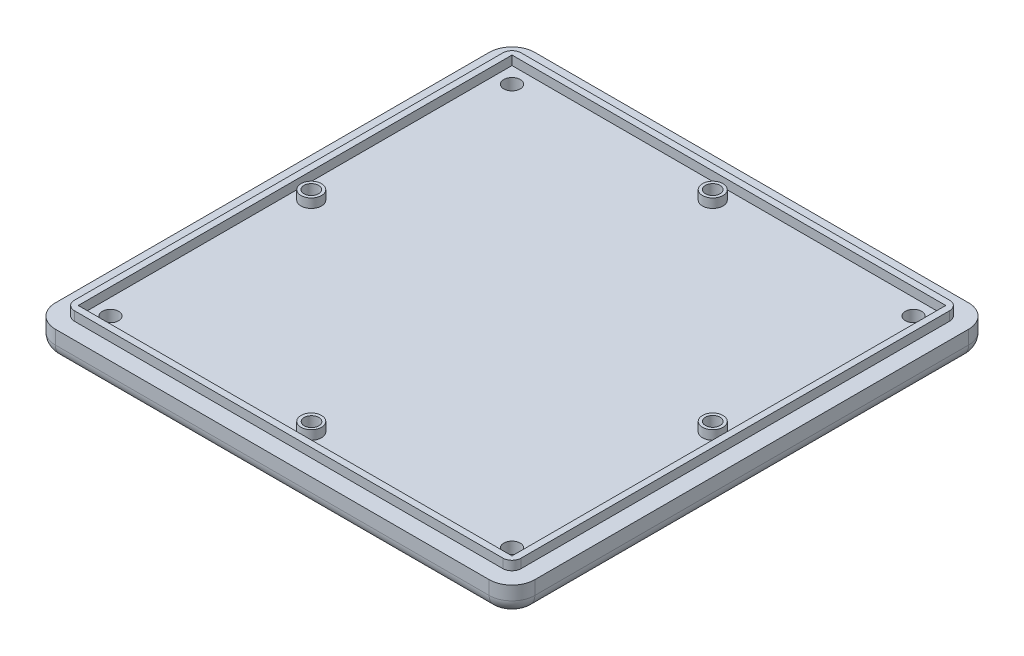
from build123d import *

# Parameters (mm, degrees)
BOSS_EXTRUDE1_DEPTH                             = 6
FILLET1_R                                       = 3
CSK_FOR_M3_FLAT_HEAD_MACHINE_SCREW1_D           = 3.6
CSK_FOR_M3_FLAT_HEAD_MACHINE_SCREW1_CSINK_D     = 6.3
CSK_FOR_M3_FLAT_HEAD_MACHINE_SCREW1_CSINK_ANGLE = 90
SKETCH5_W                                       = 95
SKETCH5_H                                       = 95
BOSS_EXTRUDE2_DEPTH                             = 2
SKETCH6_R                                       = 2.25
BOSS_EXTRUDE3_DEPTH                             = 2
M3_CLEARANCE_HOLE1_D                            = 3.2
M3_CLEARANCE_HOLE1_DEPTH                        = 5
M3_CLEARANCE_HOLE1_TIP                          = 0.96137699


with BuildPart() as part:
    # Sketch1 → Boss-Extrude1 (new body)
    with BuildSketch(Plane(origin=(0, 0, 0), x_dir=(1, 0, 0), z_dir=(0, 1, 0))):
        with BuildLine():
            Line((5, 0), (100, 0))
            ThreePointArc((100, 0), (103.535533906, 1.464466094), (105, 5))
            Line((105, 5), (105, 100))
            ThreePointArc((105, 100), (103.535533906, 103.535533906), (100, 105))
            Line((100, 105), (5, 105))
            ThreePointArc((5, 105), (1.464466094, 103.535533906), (0, 100))
            Line((0, 100), (0, 5))
            ThreePointArc((0, 5), (1.464466094, 1.464466094), (5, 0))
        make_face()
    extrude(amount=BOSS_EXTRUDE1_DEPTH)

    # Fillet1
    fillet1_edges = [part.edges().sort_by_distance(p)[0] for p in [
        (52.5, 0, -105),
        (103.535533906, 0, -103.535533906),
        (105, 0, -52.5),
        (103.535533906, 0, -1.464466094),
        (52.5, 0, 0),
        (1.464466094, 0, -1.464466094),
        (0, 0, -52.5),
        (1.464466094, 0, -103.535533906),
    ]]
    fillet(fillet1_edges, radius=FILLET1_R)

    # CSK for M3 Flat Head Machine Screw1 (through all)
    with Locations(Plane(origin=(8.535533906, 0, -8.535533906), x_dir=(0, 0, -1), z_dir=(0, -1, 0))):
        with Locations((0, 0), (87.928932188, 0), (87.928932188, 87.928932188), (0, 87.928932188)):
            CounterSinkHole(CSK_FOR_M3_FLAT_HEAD_MACHINE_SCREW1_D / 2, CSK_FOR_M3_FLAT_HEAD_MACHINE_SCREW1_CSINK_D / 2, counter_sink_angle=CSK_FOR_M3_FLAT_HEAD_MACHINE_SCREW1_CSINK_ANGLE)

    # Sketch5 → Boss-Extrude2 (add)
    with BuildSketch(Plane(origin=(0, 6, 0), x_dir=(1, 0, 0), z_dir=(0, 1, 0))):
        with BuildLine():
            Line((5.585786438, 3.585786438), (99.414213562, 3.585786438))
            ThreePointArc((99.414213562, 3.585786438), (100.828427125, 4.171572875), (101.414213562, 5.585786438))
            Line((101.414213562, 5.585786438), (101.414213562, 99.414213562))
            ThreePointArc((101.414213562, 99.414213562), (100.828427125, 100.828427125), (99.414213562, 101.414213562))
            Line((99.414213562, 101.414213562), (5.585786438, 101.414213562))
            ThreePointArc((5.585786438, 101.414213562), (4.171572875, 100.828427125), (3.585786438, 99.414213562))
            Line((3.585786438, 99.414213562), (3.585786438, 5.585786438))
            ThreePointArc((3.585786438, 5.585786438), (4.171572875, 4.171572875), (5.585786438, 3.585786438))
        make_face()
        with Locations((52.5, 52.5)):
            Rectangle(SKETCH5_W, SKETCH5_H, mode=Mode.SUBTRACT)
    extrude(amount=BOSS_EXTRUDE2_DEPTH)

    # Sketch6 → Boss-Extrude3 (add)
    with BuildSketch(Plane(origin=(0, 6, 0), x_dir=(1, 0, 0), z_dir=(0, 1, 0))):
        with Locations(Location((8.535533906, 52.5, 0), (0, 0, 270))):
            Circle(SKETCH6_R)
        with Locations(Location((52.5, 8.535533906, 0), (0, 0, 270))):
            Circle(SKETCH6_R)
        with Locations(Location((96.464466094, 52.5, 0), (0, 0, 270))):
            Circle(SKETCH6_R)
        with Locations(Location((52.5, 96.464466094, 0), (0, 0, 270))):
            Circle(SKETCH6_R)
    extrude(amount=BOSS_EXTRUDE3_DEPTH)

    # M3 Clearance Hole1
    with Locations(Plane(origin=(8.535533906, 8, -52.5), x_dir=(0, 0, 1), z_dir=(0, 1, 0))):
        with Locations((0, 0), (43.983643016, 44.044146607), (0, 87.928932188), (-43.964466094, 43.964466094)):
            Hole(M3_CLEARANCE_HOLE1_D / 2, depth=M3_CLEARANCE_HOLE1_DEPTH)
            with Locations((0, 0, -(M3_CLEARANCE_HOLE1_DEPTH + M3_CLEARANCE_HOLE1_TIP / 2))):  # 118° drill point
                Cone(0, M3_CLEARANCE_HOLE1_D / 2, M3_CLEARANCE_HOLE1_TIP, mode=Mode.SUBTRACT)


solid = part.part
